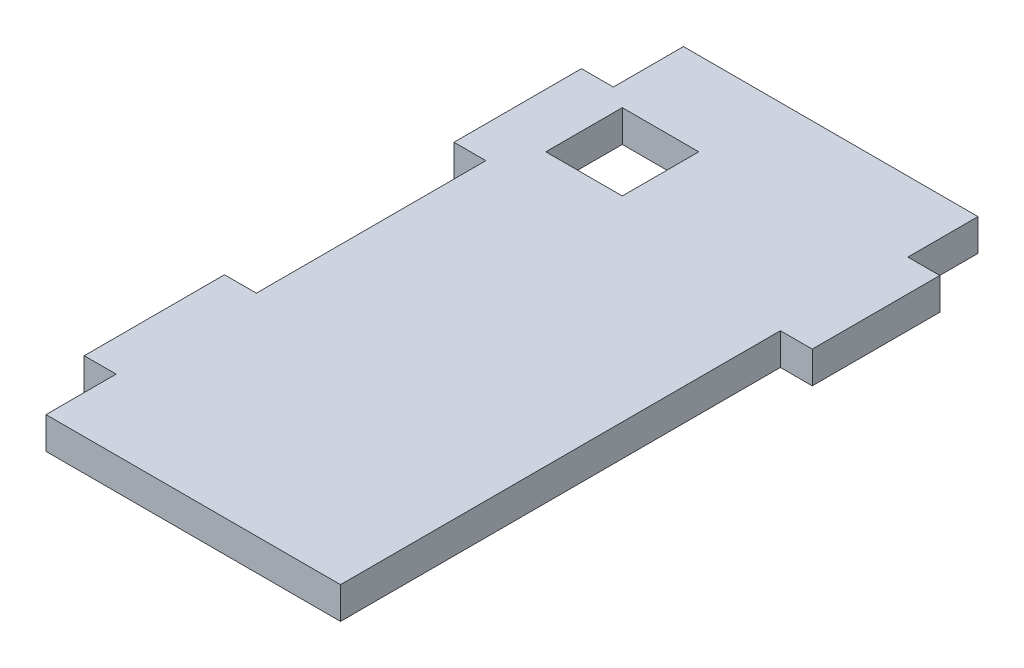
from build123d import *

# Parameters (mm, degrees)
BOSS_EXTRUDE1_DEPTH = 6.35
SKETCH4_W           = 15.24
SKETCH4_H           = 15.24
CUT_EXTRUDE1_DEPTH  = 6.35


with BuildPart() as part:
    # Sketch1 → Boss-Extrude1 (new body)
    with BuildSketch(Plane(origin=(0, 0, 0), x_dir=(1, 0, 0), z_dir=(0, 1, 0))):
        Polygon((0, 113.03), (0, 127), (58.674, 127), (58.674, 113.03), (65.024, 113.03), (65.024, 87.63), (58.674, 87.63), (58.674, 0), (0, 0), (0, 13.97), (-6.35, 13.97), (-6.35, 41.91), (0, 41.91), (0, 87.63), (-6.35, 87.63), (-6.35, 113.03), align=None)
    extrude(amount=BOSS_EXTRUDE1_DEPTH)

    # Sketch4 → Cut-Extrude1 (cut)
    with BuildSketch(Plane(origin=(0, 6.35, 0), x_dir=(1, 0, 0), z_dir=(0, 1, 0))):
        with Locations((12.065, 102.743)):
            Rectangle(SKETCH4_W, SKETCH4_H)
    extrude(amount=-CUT_EXTRUDE1_DEPTH, mode=Mode.SUBTRACT)


solid = part.part
